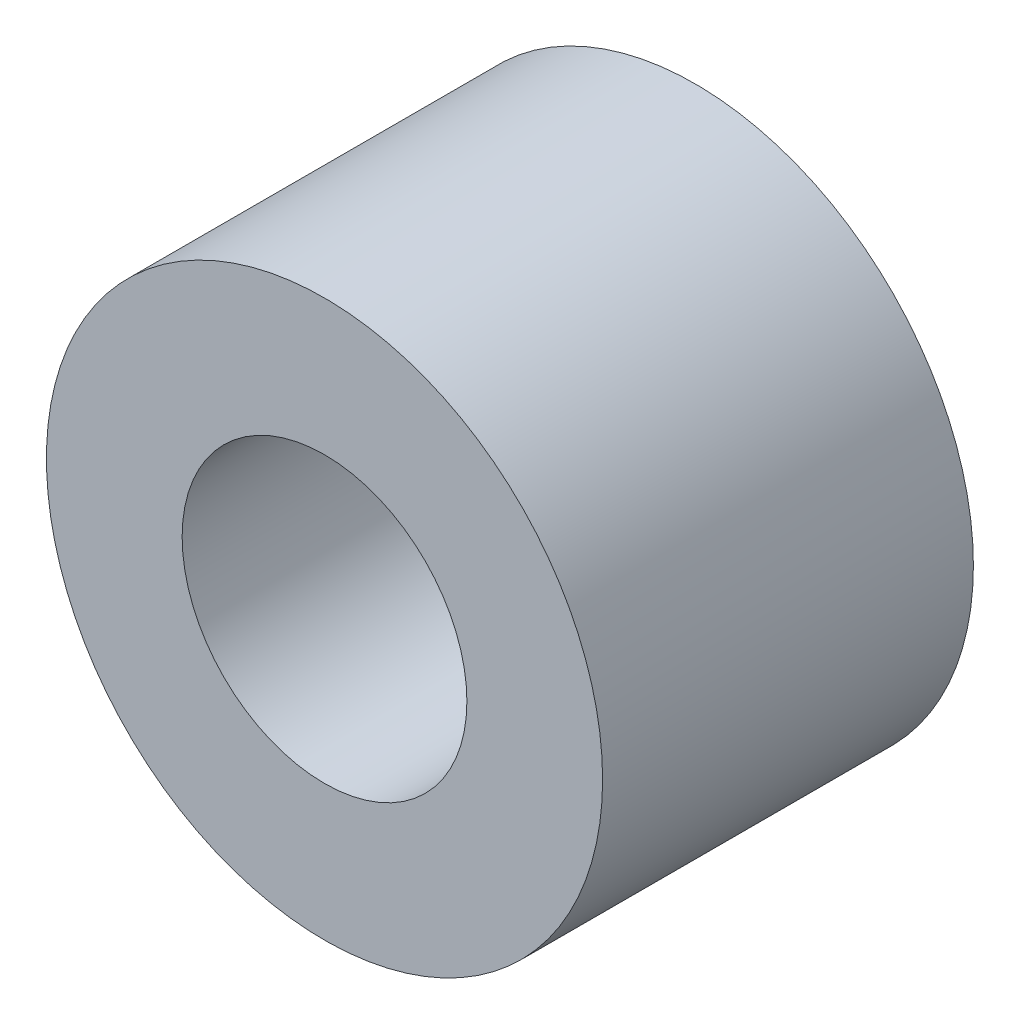
from build123d import *

# Parameters (mm, degrees)
SKETCH1_R      = 4.7625
SKETCH1_R_2    = 2.4384
EXTRUDE1_DEPTH = 3.175


with BuildPart() as part:
    # Sketch1 → Extrude1 (new, symmetric)
    with BuildSketch(Plane.XY):
        Circle(SKETCH1_R)
        Circle(SKETCH1_R_2, mode=Mode.SUBTRACT)
    extrude(amount=EXTRUDE1_DEPTH, both=True)


solid = part.part
